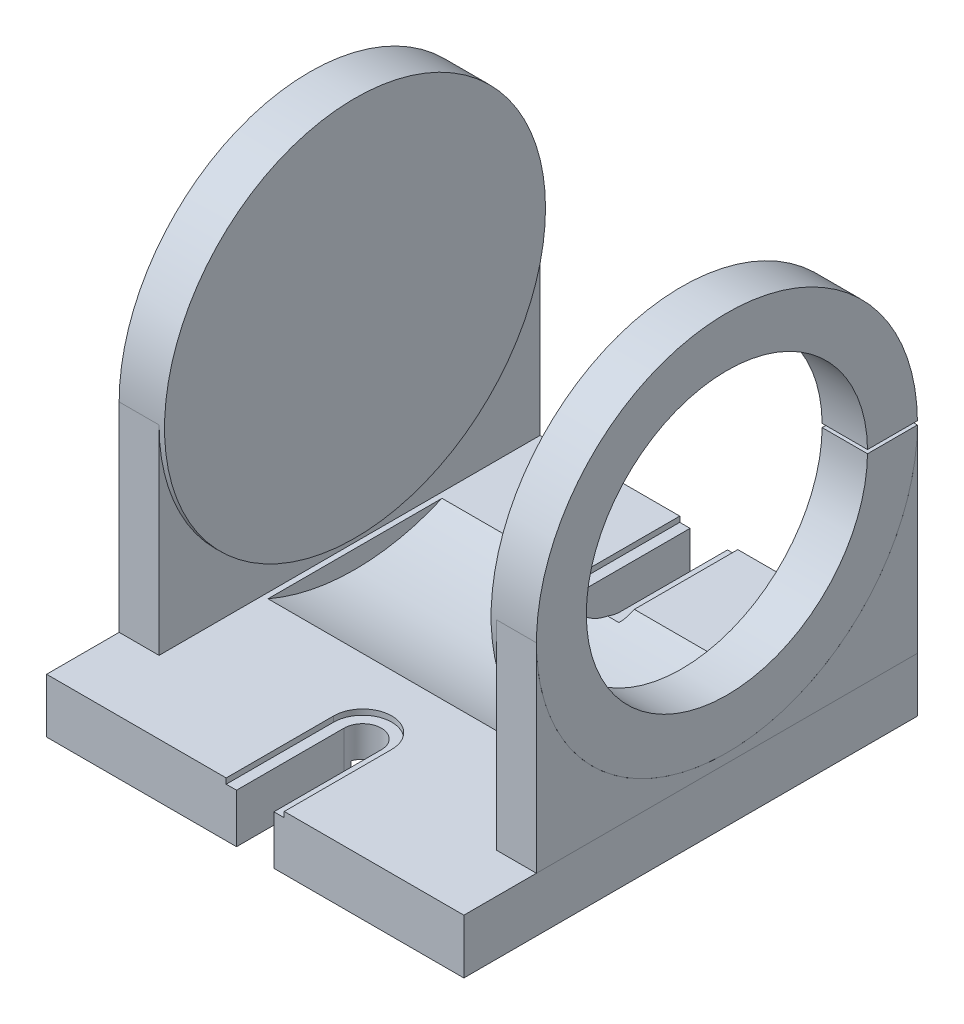
from build123d import *

# Parameters (mm, degrees)
SKETCH_3_W           = 230
SKETCH_3_H           = 250
EXTRUDE_1_DEPTH      = 30
CUT_EXTRUDE_1_DEPTH  = 30
CUT_EXTRUDE_2_DEPTH  = 3
CUT_EXTRUDE_START    = -30
SKETCH_5_W           = 20.61
SKETCH_5_H           = 131.50590542
CUT_EXTRUDE_3_DEPTH  = 4
EXTRUDE_START        = 115
SKETCH_6_R           = 105
EXTRUDE_2_DEPTH      = 25
EXTRUDE_START_2      = -115
SKETCH_6_5_R         = 105
EXTRUDE_3_DEPTH      = 25
EXTRUDE_4_DEPTH      = 22
EXTRUDE_5_DEPTH      = 22
SKETCH_10_R          = 120
CUT_EXTRUDE_10_DEPTH = 90
SKETCH_11_R          = 77.5
CUT_EXTRUDE_11_DEPTH = 25
SKETCH_12_W          = 57.586141253
SKETCH_12_H          = 168.151532458
CUT_EXTRUDE_12_DEPTH = 1
CUT_EXTRUDE_START_2  = 156
SKETCH_13_R          = 8.5
CUT_EXTRUDE_13_DEPTH = 143.119103715
SKETCH_14_R          = 5.5
CUT_EXTRUDE_14_DEPTH = 18
CUT_EXTRUDE_START_3  = 154
SKETCH_15_R          = 8.5
CUT_EXTRUDE_15_DEPTH = 145.119103878
SKETCH_16_R          = 5.5
CUT_EXTRUDE_16_DEPTH = 13
SKETCH_21_W          = 180
SKETCH_21_H          = 125
CUT_EXTRUDE_17_DEPTH = 10
FILLET_1_R           = 10


with BuildPart() as part:
    # 草图3 → 凸台-拉伸1 (new body)
    with BuildSketch(Plane(origin=(0, 0, 0), x_dir=(1, 0, 0), z_dir=(0, 1, 0))):
        Rectangle(SKETCH_3_W, SKETCH_3_H)
    extrude(amount=EXTRUDE_1_DEPTH)

    # 草图4 → 切除-拉伸1 (cut)
    with BuildSketch(Plane(origin=(0, 30, 0), x_dir=(1, 0, 0), z_dir=(0, 1, 0))):
        with BuildLine():
            Line((-10.305, -65.75295271), (-10.305, -125))
            Line((-10.305, -125), (10.305, -125))
            Line((10.305, -125), (10.305, -65.75295271))
            ThreePointArc((10.305, -65.75295271), (0, -55.44795271), (-10.305, -65.75295271))
        make_face()
    cut_extrude_1 = extrude(amount=-CUT_EXTRUDE_1_DEPTH, mode=Mode.SUBTRACT)

    # 草图4<3> → 切除-拉伸2 (cut)
    with BuildSketch(Plane(origin=(0, 30, 0), x_dir=(1, 0, 0), z_dir=(0, 1, 0))):
        with BuildLine():
            ThreePointArc((16, -65.75295271), (0, -49.75295271), (-16, -65.75295271))
            Line((-16, -65.75295271), (-16, -125))
            Line((-16, -125), (-10.305, -125))
            Line((-10.305, -125), (-10.305, -65.75295271))
            ThreePointArc((-10.305, -65.75295271), (0, -55.44795271), (10.305, -65.75295271))
            Line((10.305, -65.75295271), (10.305, -125))
            Line((10.305, -125), (16, -125))
            Line((16, -125), (16, -65.75295271))
        make_face()
    cut_extrude_2 = extrude(amount=-CUT_EXTRUDE_2_DEPTH, mode=Mode.SUBTRACT)

    # 镜向1: 切除-拉伸1, 切除-拉伸2 across plane
    add(cut_extrude_1.mirror(Plane.XY), mode=Mode.SUBTRACT)
    add(cut_extrude_2.mirror(Plane.XY), mode=Mode.SUBTRACT)

    # 草图5 → 切除-拉伸3 (cut)
    with BuildSketch(Plane(origin=(0, 30, 0), x_dir=(1, 0, 0), z_dir=(0, 1, 0)).offset(CUT_EXTRUDE_START)):
        Rectangle(SKETCH_5_W, SKETCH_5_H)
    extrude(amount=CUT_EXTRUDE_3_DEPTH, mode=Mode.SUBTRACT)



with BuildPart() as body_2:
    # 草图6 → 凸台-拉伸2 (new body)
    with BuildSketch(Plane(origin=(0, 0, 0), x_dir=(0, 0, -1), z_dir=(1, 0, 0)).offset(EXTRUDE_START)):
        with Locations(Location((20, 140, 0), (0, 0, 180))):
            Circle(SKETCH_6_R)
    extrude(amount=-EXTRUDE_2_DEPTH)

    # 草图11 → 切除-拉伸11 (cut)
    with BuildSketch(Plane(origin=(115, 0, 0), x_dir=(0, 0, -1), z_dir=(1, 0, 0))):
        with Locations((20, 140)):
            Circle(SKETCH_11_R)
    extrude(amount=-CUT_EXTRUDE_11_DEPTH, mode=Mode.SUBTRACT)


with BuildPart() as body_3:
    # 草图6<5> → 凸台-拉伸3 (new body)
    with BuildSketch(Plane(origin=(0, 0, 0), x_dir=(0, 0, -1), z_dir=(1, 0, 0)).offset(EXTRUDE_START_2)):
        with Locations(Location((20, 140, 0), (0, 0, 180))):
            Circle(SKETCH_6_5_R)
    extrude(amount=EXTRUDE_3_DEPTH)


with BuildPart() as body_4:
    # 草图6<8> → 凸台-拉伸4 (new body)
    with BuildSketch(Plane(origin=(0, 0, 0), x_dir=(0, 0, -1), z_dir=(1, 0, 0)).offset(EXTRUDE_START)):
        with BuildLine():
            Line((-85, 30), (125, 30))
            Line((125, 30), (125, 140))
            ThreePointArc((125, 140), (20, 35), (-85, 140))
            Line((-85, 140), (-85, 30))
        make_face()
    extrude(amount=-EXTRUDE_4_DEPTH)


with BuildPart() as part_1:
    add(part.part)

    add(body_3.part)  # 凸台-拉伸5 merges body 3
    # 草图6<10> → 凸台-拉伸5 (add)
    with BuildSketch(Plane(origin=(0, 0, 0), x_dir=(0, 0, -1), z_dir=(1, 0, 0)).offset(EXTRUDE_START_2)):
        with BuildLine():
            Line((-85, 30), (125, 30))
            Line((125, 30), (125, 140))
            ThreePointArc((125, 140), (20, 35), (-85, 140))
            Line((-85, 140), (-85, 30))
        make_face()
    extrude(amount=EXTRUDE_5_DEPTH)

    # 草图10 → 切除-拉伸10 (cut, symmetric)
    with BuildSketch(Plane(origin=(0, 0, 0), x_dir=(0, 0, -1), z_dir=(1, 0, 0))):
        with Locations((20, 140)):
            Circle(SKETCH_10_R)
    extrude(amount=CUT_EXTRUDE_10_DEPTH, both=True, mode=Mode.SUBTRACT)

    # 草图13 → 切除-拉伸13 (cut, through all)
    with BuildSketch(Plane(origin=(0, 0, 0), x_dir=(1, 0, 0), z_dir=(0, 1, 0)).offset(CUT_EXTRUDE_START_2)):
        with BuildLine():
            Line((-112.5, 138.339436781), (-112.5, 113))
            ThreePointArc((-112.5, 113), (-104, 121.5), (-95.5, 113))
            Line((-95.5, 113), (-95.5, 138.339436781))
            Line((-95.5, 138.339436781), (-112.5, 138.339436781))
        make_face()
        with Locations((-104, 113)):
            Circle(SKETCH_13_R)
    extrude(amount=CUT_EXTRUDE_13_DEPTH, mode=Mode.SUBTRACT)

    # 草图14 → 切除-拉伸14 (cut)
    with BuildSketch(Plane(origin=(0, 156, 0), x_dir=(1, 0, 0), z_dir=(0, 1, 0))):
        with Locations(Location((-104, 113, 0), (0, 0, 270))):
            Circle(SKETCH_14_R)
    extrude(amount=-CUT_EXTRUDE_14_DEPTH, mode=Mode.SUBTRACT)

    # 草图18 → M10 螺纹孔1 (revolve, cut)
    with BuildSketch(Plane(origin=(-104, 138, -113), x_dir=(0, 0, 1), z_dir=(1, 0, 0))):
        Polygon((0, 0), (0, 32.553657631), (4.25, 30), (4.25, 0), align=None)
    revolve(axis=Axis((-104, 144.35, -113), (0, -1, 0)), mode=Mode.SUBTRACT)

    # 草图21 → 切除-拉伸17 (cut)
    with BuildSketch(Plane.XZ):
        Rectangle(SKETCH_21_W, SKETCH_21_H)
    extrude(amount=-CUT_EXTRUDE_17_DEPTH, mode=Mode.SUBTRACT)

    # 圆角1
    fillet_1_edges = [part_1.edges().sort_by_distance(p)[0] for p in [
        (-90, 5, 62.5),
        (90, 5, -62.5),
        (-90, 5, -62.5),
        (90, 5, 62.5),
    ]]
    fillet(fillet_1_edges, radius=FILLET_1_R)


with BuildPart() as cut_extrude_12_tool:
    # 草图12 → 切除-拉伸12 (new, symmetric)
    with BuildSketch(Plane(origin=(0, 140, 0), x_dir=(-1, 0, 0), z_dir=(0, -1, 0))):
        with Locations((-101.857491759, 81.196459166)):
            Rectangle(SKETCH_12_W, SKETCH_12_H)
    extrude(amount=CUT_EXTRUDE_12_DEPTH, both=True)


with BuildPart() as body_2_1:
    add(body_2.part)

    # 切除-拉伸12: cut by cut_extrude_12_tool
    add(cut_extrude_12_tool.part, mode=Mode.SUBTRACT)

    # 草图15 → 切除-拉伸15 (cut, through all)
    with BuildSketch(Plane(origin=(0, 0, 0), x_dir=(1, 0, 0), z_dir=(0, 1, 0)).offset(CUT_EXTRUDE_START_3)):
        with Locations((102.5, 112.995237987)):
            Circle(SKETCH_15_R)
        with BuildLine():
            Line((94, 134.956488476), (94, 112.995237987))
            ThreePointArc((94, 112.995237987), (102.5, 121.495237987), (111, 112.995237987))
            Line((111, 112.995237987), (111, 134.956488476))
            Line((111, 134.956488476), (94, 134.956488476))
        make_face()
    extrude(amount=CUT_EXTRUDE_15_DEPTH, mode=Mode.SUBTRACT)

    # 草图16 → 切除-拉伸16 (cut)
    with BuildSketch(Plane(origin=(0, 154, 0), x_dir=(1, 0, 0), z_dir=(0, 1, 0))):
        with Locations(Location((102.5, 112.995237987, 0), (0, 0, 270))):
            Circle(SKETCH_16_R)
    extrude(amount=-CUT_EXTRUDE_16_DEPTH, mode=Mode.SUBTRACT)

    # 草图20 → M10 螺纹孔2 (revolve, cut)
    with BuildSketch(Plane(origin=(102.5, 139, -112.995237987), x_dir=(0, 0, 1), z_dir=(1, 0, 0))):
        Polygon((0, 0), (0, 32.553657631), (4.25, 30), (4.25, 0), align=None)
    revolve(axis=Axis((102.5, 145.35, -112.995237987), (0, -1, 0)), mode=Mode.SUBTRACT)


with BuildPart() as body_4_1:
    add(body_4.part)

    # 切除-拉伸12: cut by cut_extrude_12_tool
    add(cut_extrude_12_tool.part, mode=Mode.SUBTRACT)


solid = Compound([part_1.part, body_2_1.part, body_4_1.part])
